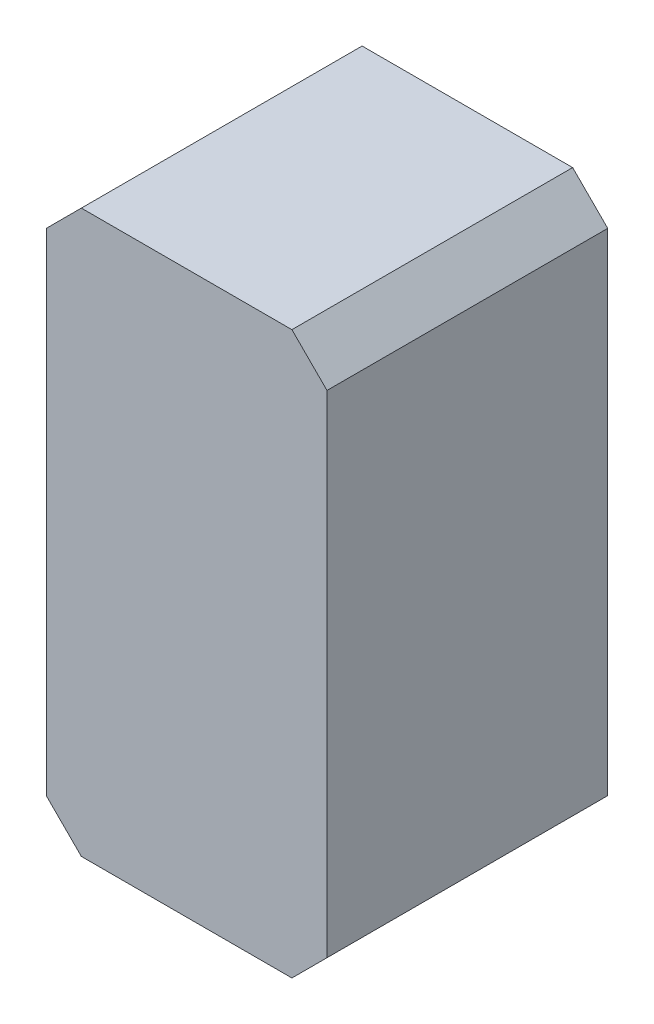
from build123d import *

# Parameters (mm, degrees)
SKETCH1_W           = 4
SKETCH1_H           = 8
BOSS_EXTRUDE1_DEPTH = 4
CHAMFER1_SIZE       = 0.5


with BuildPart() as part:
    # Sketch1 → Boss-Extrude1 (new body)
    with BuildSketch(Plane.XY):
        Rectangle(SKETCH1_W, SKETCH1_H)
    extrude(amount=BOSS_EXTRUDE1_DEPTH)

    # Chamfer1
    chamfer1_edges = [part.edges().sort_by_distance(p)[0] for p in [
        (2, -4, 2),
        (-2, -4, 2),
        (-2, 4, 2),
        (2, 4, 2),
    ]]
    chamfer(chamfer1_edges, length=CHAMFER1_SIZE)


solid = part.part
